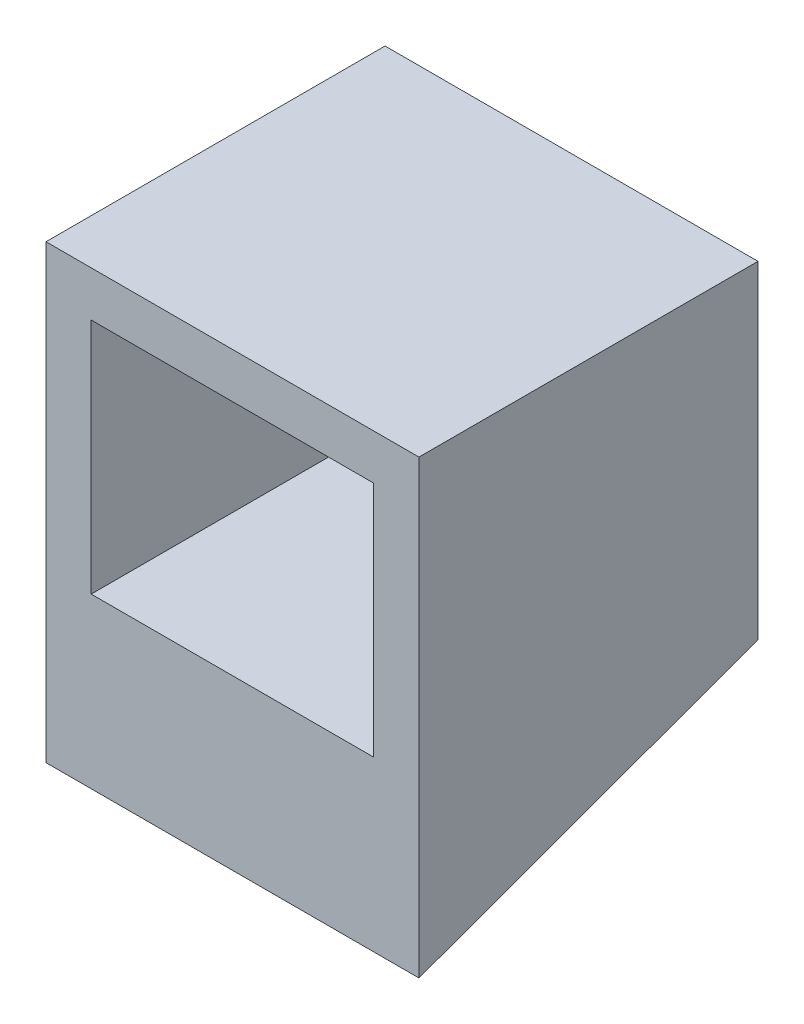
from build123d import *

# Parameters (mm, degrees)
SKETCH1_W           = 16.5
SKETCH1_H           = 14.5
SKETCH1_W_2         = 12.5
SKETCH1_H_2         = 10.5
BOSS_EXTRUDE1_DEPTH = 15
BOSS_EXTRUDE2_DEPTH = 16.5


with BuildPart() as part:
    # Sketch1 → Boss-Extrude1 (new body)
    with BuildSketch(Plane.XY):
        with Locations((6.25, -5.25)):
            Rectangle(SKETCH1_W, SKETCH1_H)
        with Locations((6.25, -5.25)):
            Rectangle(SKETCH1_W_2, SKETCH1_H_2, mode=Mode.SUBTRACT)
    extrude(amount=BOSS_EXTRUDE1_DEPTH)

    # Sketch2 → Boss-Extrude2 (add)
    with BuildSketch(Plane.ZY.offset(2)):
        Polygon((0, -12.5), (15, -17.959553514), (15, -12.5), align=None)
    extrude(amount=-BOSS_EXTRUDE2_DEPTH)


solid = part.part
